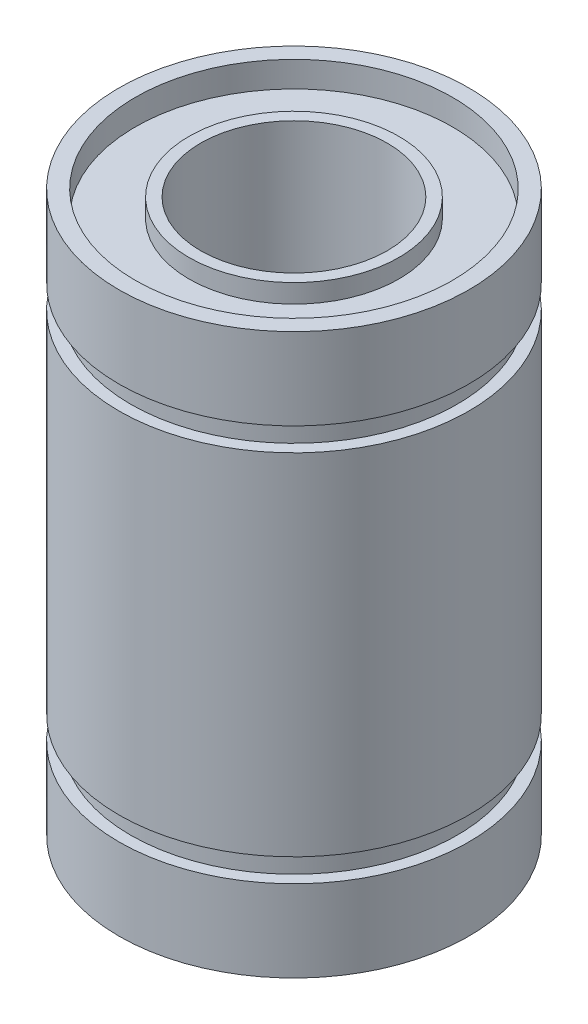
from build123d import *

# Parameters (mm, degrees)
SKETCH1_R           = 7.5
BOSS_EXTRUDE1_DEPTH = 12
SKETCH2_R           = 4
CUT_EXTRUDE1_DEPTH  = 24
CUT_EXTRUDE2_START  = -3.5
SKETCH3_R           = 7.5
SKETCH3_R_2         = 7
CUT_EXTRUDE2_DEPTH  = 1


with BuildPart() as part:
    # Sketch1 → Boss-Extrude1 (new, symmetric)
    with BuildSketch(Plane(origin=(0, 0, 0), x_dir=(1, 0, 0), z_dir=(0, 1, 0))):
        with Locations(Location((0, 0, 0), (0, 0, 270))):
            Circle(SKETCH1_R)
    extrude(amount=BOSS_EXTRUDE1_DEPTH, both=True)

    # Sketch2 → Cut-Extrude1 (cut)
    with BuildSketch(Plane(origin=(0, 12, 0), x_dir=(1, 0, 0), z_dir=(0, 1, 0))):
        with Locations(Location((0, 0, 0), (0, 0, 270))):
            Circle(SKETCH2_R)
    extrude(amount=-CUT_EXTRUDE1_DEPTH, mode=Mode.SUBTRACT)

    # Sketch3 → Cut-Extrude2 (cut)
    with BuildSketch(Plane(origin=(0, 12, 0), x_dir=(1, 0, 0), z_dir=(0, 1, 0)).offset(CUT_EXTRUDE2_START)):
        with Locations(Location((0, 0, 0), (0, 0, 270))):
            Circle(SKETCH3_R)
        with Locations(Location((0, 0, 0), (0, 0, 270))):
            Circle(SKETCH3_R_2, mode=Mode.SUBTRACT)
    cut_extrude2 = extrude(amount=-CUT_EXTRUDE2_DEPTH, mode=Mode.SUBTRACT)

    # Sketch4 → Cut-Revolve1 (revolve, cut)
    with BuildSketch(Plane(origin=(0, 0, 0), x_dir=(0, 0, -1), z_dir=(1, 0, 0)), mode=Mode.PRIVATE) as cut_revolve1_sk:
        Polygon((4, 12), (4, 11.7), (4.5, 11.7), (4.5, 10.9), (6.8, 10.9), (6.8, 12), align=None)
    cut_revolve1 = revolve(cut_revolve1_sk.sketch.rotate(Axis((0, 10.5, 0), (0, -1, 0)), 180), axis=Axis((0, 10.5, 0), (0, -1, 0)), mode=Mode.SUBTRACT)

    # Mirror1: Cut-Extrude2, Cut-Revolve1 across plane
    add(cut_extrude2.mirror(Plane.ZX), mode=Mode.SUBTRACT)
    add(cut_revolve1.mirror(Plane.ZX), mode=Mode.SUBTRACT)


solid = part.part
